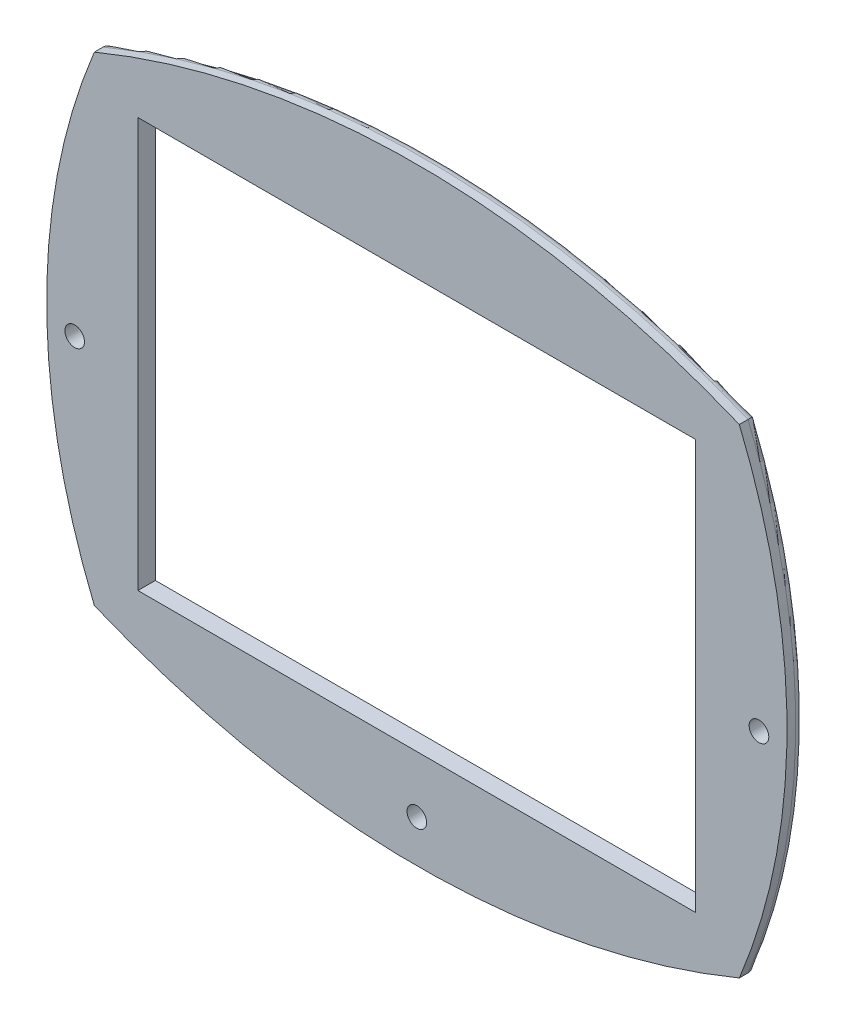
from build123d import *

# Parameters (mm, degrees)
SKETCH1_W           = 64
SKETCH1_H           = 47
BOSS_EXTRUDE1_DEPTH = 2
FILLET1_R           = 1
SKETCH2_R           = 1.125
CUT_EXTRUDE1_DEPTH  = 55.981008251


with BuildPart() as part:
    # Sketch1 → Boss-Extrude1 (new body)
    # profile 1 of 2: a face of its own
    with BuildSketch(Plane.XY):
        with BuildLine():
            ThreePointArc((37, 27.5), (42.470090103, 0), (37, -27.5))
            ThreePointArc((37, -27.5), (0, -34.859757593), (-37, -27.5))
            ThreePointArc((-37, -27.5), (-42.470090103, 0), (-37, 27.5))
            ThreePointArc((-37, 27.5), (0, 34.859757593), (37, 27.5))
        make_face()
        with BuildLine():
            ThreePointArc((36, -25.5), (40.468092327, 0), (36, 25.5))
            ThreePointArc((36, 25.5), (0, 32.351769079), (-36, 25.5))
            ThreePointArc((-36, 25.5), (-40.468092327, 0), (-36, -25.5))
            ThreePointArc((-36, -25.5), (0, -32.351769079), (36, -25.5))
        make_face(mode=Mode.SUBTRACT)
    # profile 2 of 2: a face of its own
    with BuildSketch(Plane.XY):
        with BuildLine():
            ThreePointArc((36, -25.5), (0, -32.351769079), (-36, -25.5))
            ThreePointArc((-36, -25.5), (-40.468092327, 0), (-36, 25.5))
            ThreePointArc((-36, 25.5), (0, 32.351769079), (36, 25.5))
            ThreePointArc((36, 25.5), (40.468092327, 0), (36, -25.5))
        make_face()
        Rectangle(SKETCH1_W, SKETCH1_H, mode=Mode.SUBTRACT)
    extrude(amount=BOSS_EXTRUDE1_DEPTH)

    # Fillet1
    fillet1_edges = [part.edges().sort_by_distance(p)[0] for p in [
        (-42.470090103, 0, 0),
        (0, -34.859757593, 0),
        (0, 34.859757593, 0),
        (42.470090103, 0, 0),
    ]]
    fillet(fillet1_edges, radius=FILLET1_R)

    # Sketch2 → Cut-Extrude1 (cut, through all)
    with BuildSketch(Plane(origin=(0, 0, 0), x_dir=(-1, 0, 0), z_dir=(0, 0, -1))):
        with Locations((-39.253932374, -1.86)):
            Circle(SKETCH2_R)
        with Locations((0, -30)):
            Circle(SKETCH2_R)
        with Locations((39.253932374, -1.86)):
            Circle(SKETCH2_R)
    extrude(amount=-CUT_EXTRUDE1_DEPTH, mode=Mode.SUBTRACT)


solid = part.part
